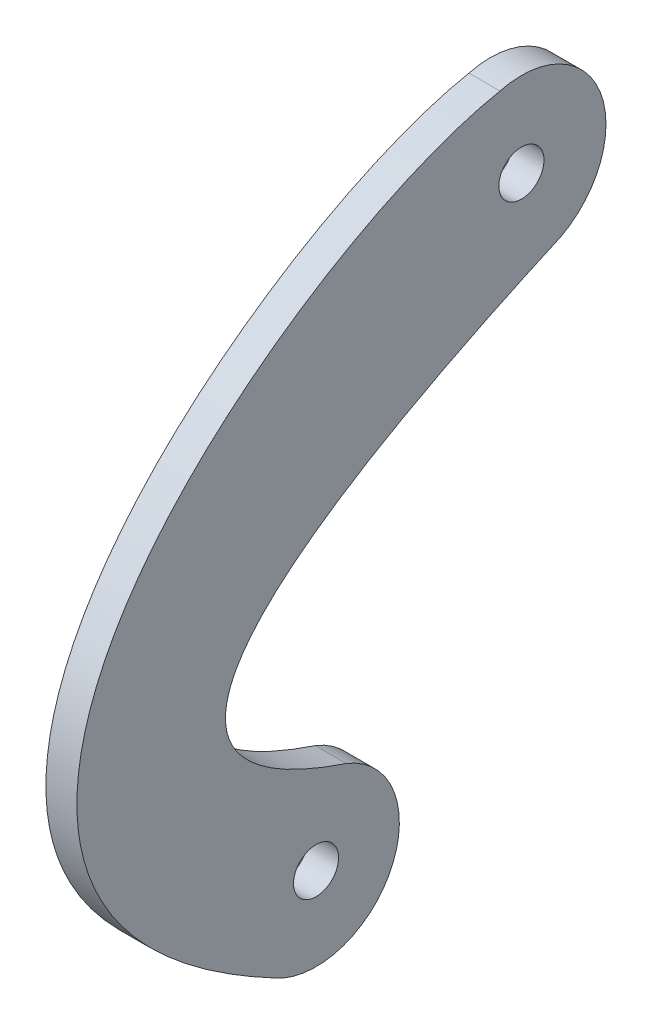
from build123d import *

# Parameters (mm, degrees)
SKETCH_1_R      = 3.999999996
SKETCH_1_R_2    = 4
EXTRUDE_1_DEPTH = 5.5


with BuildPart() as part:
    # Эскиз1 → Вытянуть1 (new body)
    with BuildSketch(Plane(origin=(0, 0, 0), x_dir=(0, 0, -1), z_dir=(1, 0, 0))):
        with BuildLine():
            ThreePointArc((-9.540871081, -26.398646507), (-2.597990728, -7.694762203), (-20.375077368, 1.361399581))
            add(Edge.make_bspline(
                [(-20.375077368, 1.361399581), (-59.744347093, -6.195572957), (-142.43517779, -71.38922898), (-60.423943676, -114.845698035)],
                knots=[0, 0, 0, 0, 1, 1, 1, 1], degree=3))
            ThreePointArc((-60.423943676, -114.845698035), (-39.682689443, -108.483068728), (-47.637725769, -88.298914648))
            add(Edge.make_bspline(
                [(-9.540871081, -26.398646507), (-57.761471468, -47.925661264), (-93.927707693, -72.902178799), (-47.637725769, -88.298914648)],
                knots=[0, 0, 0, 0, 1, 1, 1, 1], degree=3))
        make_face()
        with Locations((-16.571481544, -13.148344)):
            Circle(SKETCH_1_R, mode=Mode.SUBTRACT)
        with Locations((-52.996333561, -102.070572255)):
            Circle(SKETCH_1_R_2, mode=Mode.SUBTRACT)
    extrude(amount=EXTRUDE_1_DEPTH)


solid = part.part
